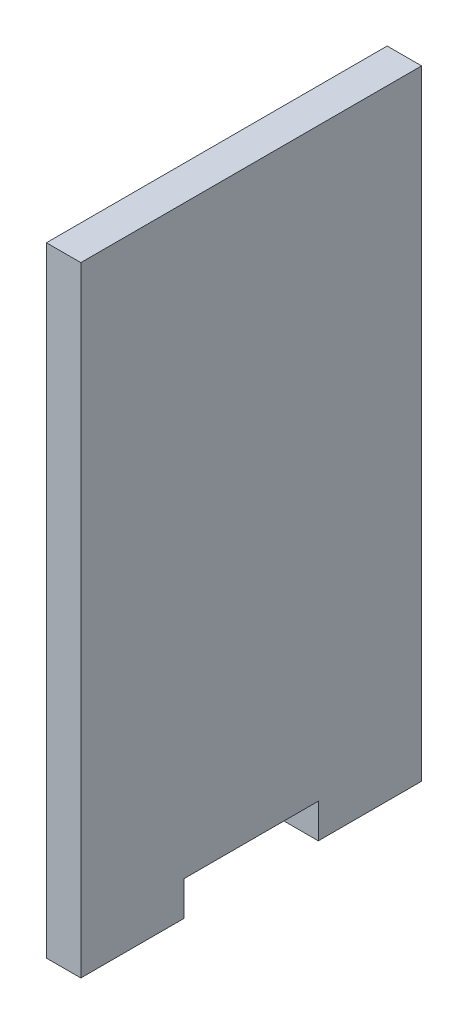
from build123d import *

# Parameters (mm, degrees)
SKETCH_1_W      = 49.5
SKETCH_1_H      = 85
EXTRUDE_1_DEPTH = 5
SKETCH_12_W     = 15
SKETCH_12_H     = 5
EXTRUDE_3_DEPTH = 5


with BuildPart() as part:
    # 스케치1 → 보스-돌출1 (new body)
    with BuildSketch(Plane(origin=(0, 0, 0), x_dir=(0, 0, -1), z_dir=(1, 0, 0))):
        with Locations((24.75, 0.767010447)):
            Rectangle(SKETCH_1_W, SKETCH_1_H)
    extrude(amount=EXTRUDE_1_DEPTH)

    # 스케치12 → 보스-돌출3 (add)
    with BuildSketch(Plane(origin=(5, 0, 0), x_dir=(0, 0, -1), z_dir=(1, 0, 0))):
        with Locations((42, -44.232989553)):
            Rectangle(SKETCH_12_W, SKETCH_12_H)
        with Locations((7.5, -44.232989553)):
            Rectangle(SKETCH_12_W, SKETCH_12_H)
    extrude(amount=-EXTRUDE_3_DEPTH)


solid = part.part
